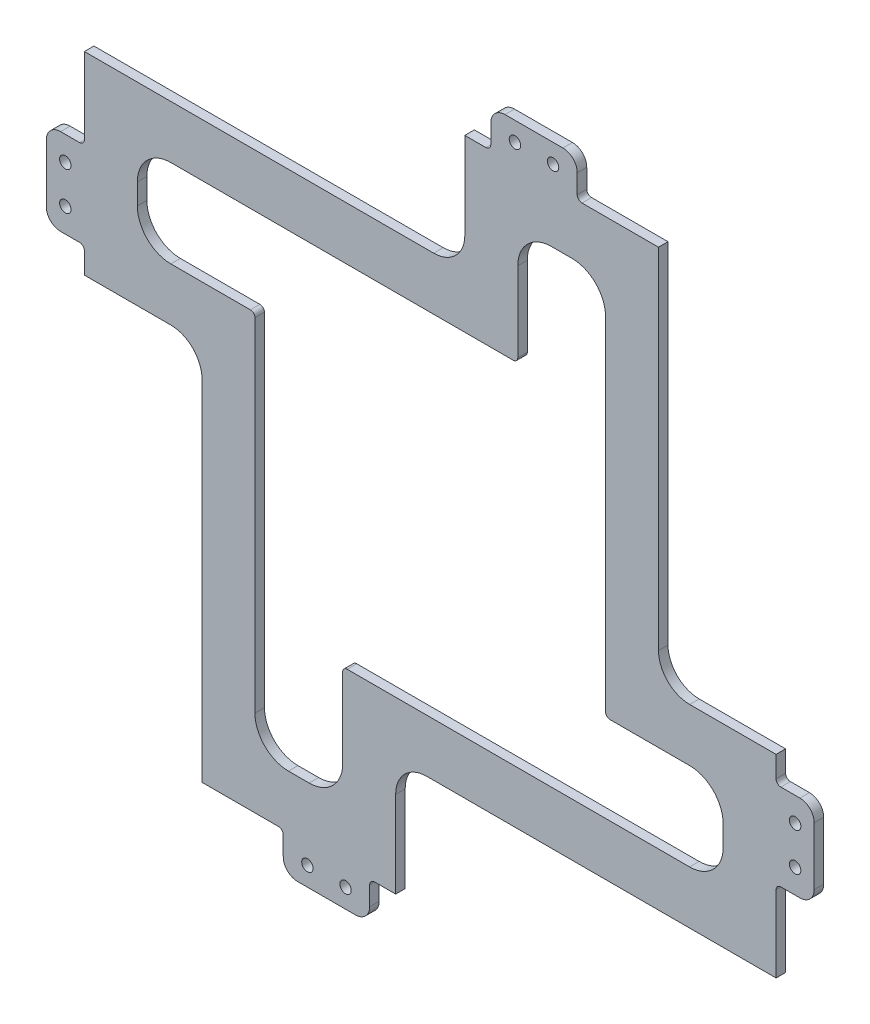
from build123d import *

# Parameters (mm, degrees)
SKETCH2_R          = 0.1524
EXTRUDE1_DEPTH     = 0.127
CIRPATTERN1_COUNT  = 4
CUT_EXTRUDE1_DEPTH = 0.381


with BuildPart() as part:
    # Sketch2 → Extrude1 (new, symmetric)
    with BuildSketch(Plane.XY):
        with BuildLine():
            Line((-3.68808, 4.6101), (2.212848, 4.6101))
            ThreePointArc((2.212848, 4.6101), (2.343241319, 4.664110681), (2.397252, 4.794504))
            Line((2.397252, 4.794504), (2.397252, 6.91515))
            ThreePointArc((2.397252, 6.91515), (2.640300065, 7.501919935), (3.22707, 7.744968))
            Line((3.22707, 7.744968), (3.780282, 7.744968))
            ThreePointArc((3.780282, 7.744968), (4.367051935, 7.501919935), (4.6101, 6.91515))
            Line((4.6101, 6.91515), (4.6101, 1.84404))
            Line((4.6101, 1.84404), (6.085332, 1.84404))
            Line((6.085332, 1.84404), (6.085332, 9.2202))
            Line((6.085332, 9.2202), (4.045585, 9.2202))
            ThreePointArc((4.045585, 9.2202), (3.955782439, 9.257397439), (3.918585, 9.3472))
            Line((3.918585, 9.3472), (3.918585, 9.8552))
            ThreePointArc((3.918585, 9.8552), (3.806992684, 10.124607684), (3.537585, 10.2362))
            Line((3.537585, 10.2362), (1.994535, 10.2362))
            ThreePointArc((1.994535, 10.2362), (1.725127316, 10.124607684), (1.613535, 9.8552))
            Line((1.613535, 9.8552), (1.613535, 9.3472))
            ThreePointArc((1.613535, 9.3472), (1.576337561, 9.257397439), (1.486535, 9.2202))
            Line((1.486535, 9.2202), (0.92202, 9.2202))
            Line((0.92202, 9.2202), (0.92202, 6.91515))
            ThreePointArc((0.92202, 6.91515), (0.678971935, 6.328380065), (0.092202, 6.085332))
            Line((0.092202, 6.085332), (-3.68808, 6.085332))
            Line((-3.68808, 6.085332), (-3.68808, 4.6101))
        make_face()
        with Locations((3.27406, 9.7282)):
            Circle(SKETCH2_R, mode=Mode.SUBTRACT)
        with Locations((2.25806, 9.7282)):
            Circle(SKETCH2_R, mode=Mode.SUBTRACT)
    extrude1 = extrude(amount=EXTRUDE1_DEPTH, both=True)

    # CirPattern1: Extrude1 ×4 about axis
    cirpattern1_axis = Axis((0, 0, -69.733664692), (0, 0, 1))
    for i in range(1, CIRPATTERN1_COUNT):
        add(extrude1.rotate(cirpattern1_axis, i * 360 / CIRPATTERN1_COUNT))

    # Sketch3 → Cut-Extrude1 (cut)
    with BuildSketch(Plane.XY.offset(0.127)):
        with BuildLine():
            Line((-7.808468, 3.780282), (-7.808468, 3.22707))
            ThreePointArc((-7.808468, 3.22707), (-7.546821216, 2.595398784), (-6.91515, 2.333752))
            Line((-6.91515, 2.333752), (-4.794504, 2.333752))
            ThreePointArc((-4.794504, 2.333752), (-4.709011962, 2.298340038), (-4.6736, 2.212848))
            Line((-4.6736, 2.212848), (-4.6736, -6.91515))
            ThreePointArc((-4.6736, -6.91515), (-4.411953216, -7.546821216), (-3.780282, -7.808468))
            Line((-3.780282, -7.808468), (-3.22707, -7.808468))
            ThreePointArc((-3.22707, -7.808468), (-2.595398784, -7.546821216), (-2.333752, -6.91515))
            Line((-2.333752, -6.91515), (-2.333752, -4.794504))
            ThreePointArc((-2.333752, -4.794504), (-2.298340038, -4.709011962), (-2.212848, -4.6736))
            Line((-2.212848, -4.6736), (6.91515, -4.6736))
            ThreePointArc((6.91515, -4.6736), (7.546821216, -4.411953216), (7.808468, -3.780282))
            Line((7.808468, -3.780282), (7.808468, -3.22707))
            ThreePointArc((7.808468, -3.22707), (7.546821216, -2.595398784), (6.91515, -2.333752))
            Line((6.91515, -2.333752), (4.794504, -2.333752))
            ThreePointArc((4.794504, -2.333752), (4.709011962, -2.298340038), (4.6736, -2.212848))
            Line((4.6736, -2.212848), (4.6736, 6.91515))
            ThreePointArc((4.6736, 6.91515), (4.411953216, 7.546821216), (3.780282, 7.808468))
            Line((3.780282, 7.808468), (3.22707, 7.808468))
            ThreePointArc((3.22707, 7.808468), (2.595398784, 7.546821216), (2.333752, 6.91515))
            Line((2.333752, 6.91515), (2.333752, 4.794504))
            ThreePointArc((2.333752, 4.794504), (2.298340038, 4.709011962), (2.212848, 4.6736))
            Line((2.212848, 4.6736), (-6.91515, 4.6736))
            ThreePointArc((-6.91515, 4.6736), (-7.546821216, 4.411953216), (-7.808468, 3.780282))
        make_face()
    extrude(amount=-CUT_EXTRUDE1_DEPTH, mode=Mode.SUBTRACT)


solid = part.part
